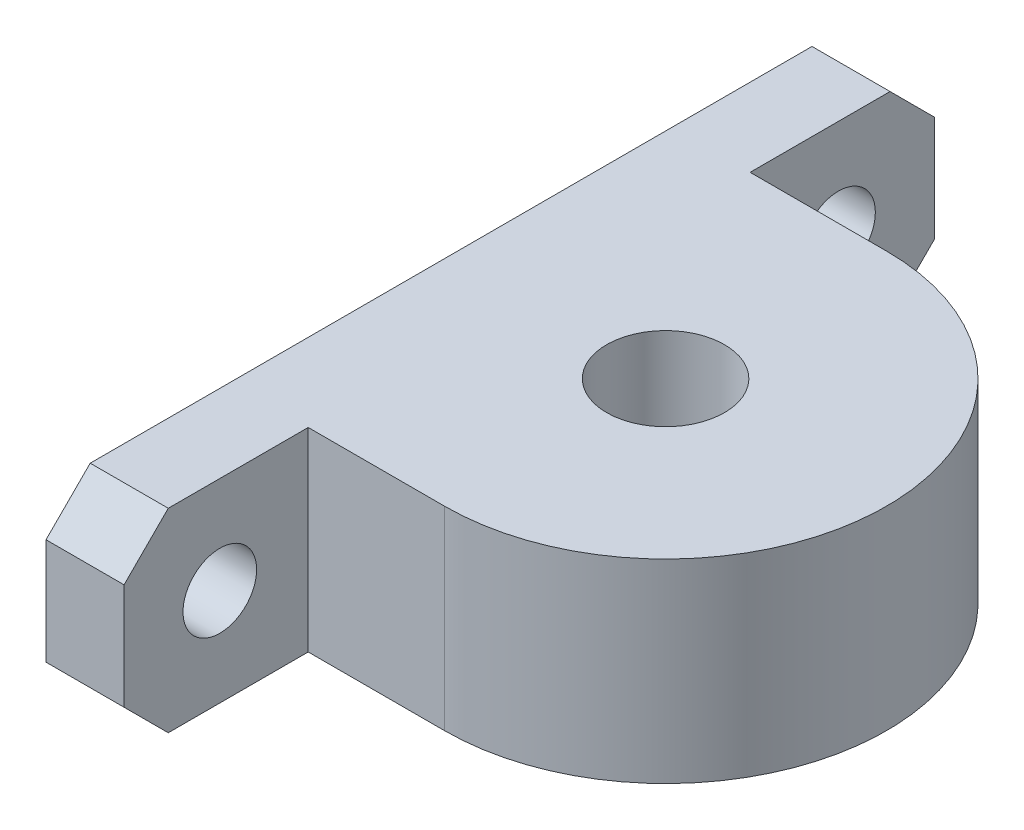
from build123d import *

# Parameters (mm, degrees)
SKETCH2_R                = 4
BOSS_EXTRUDE2_DEPTH      = 13.2
F_5_0_5_DIAMETER_HOLE1_D = 5
CHAMFER1_SIZE            = 3


with BuildPart() as part:
    # Sketch2 → Boss-Extrude2 (new body)
    with BuildSketch(Plane(origin=(0, 0, 0), x_dir=(1, 0, 0), z_dir=(0, 1, 0))):
        with BuildLine():
            Line((-14.56, -27.5), (-9.26, -27.5))
            Line((-9.26, -27.5), (-9.26, -15))
            Line((-9.26, -15), (0, -15))
            ThreePointArc((0, -15), (15, 0), (0, 15))
            Line((0, 15), (-9.26, 15))
            Line((-9.26, 15), (-9.26, 27.5))
            Line((-9.26, 27.5), (-14.56, 27.5))
            Line((-14.56, 27.5), (-14.56, -27.5))
        make_face()
        with Locations(Location((0, 0, 0), (0, 0, 270))):
            Circle(SKETCH2_R, mode=Mode.SUBTRACT)
    extrude(amount=BOSS_EXTRUDE2_DEPTH)

    # Ø5.0 (5) Diameter Hole1 (through all)
    with Locations(Plane(origin=(-9.26, 0, 0), x_dir=(0, 0, -1), z_dir=(1, 0, 0))):
        with Locations((21, 6.6), (-21, 6.6)):
            Hole(F_5_0_5_DIAMETER_HOLE1_D / 2)

    # Chamfer1
    chamfer1_edges = [part.edges().sort_by_distance(p)[0] for p in [
        (-11.91, 0, -27.5),
        (-11.91, 13.2, -27.5),
        (-11.91, 13.2, 27.5),
        (-11.91, 0, 27.5),
    ]]
    chamfer(chamfer1_edges, length=CHAMFER1_SIZE)


solid = part.part
